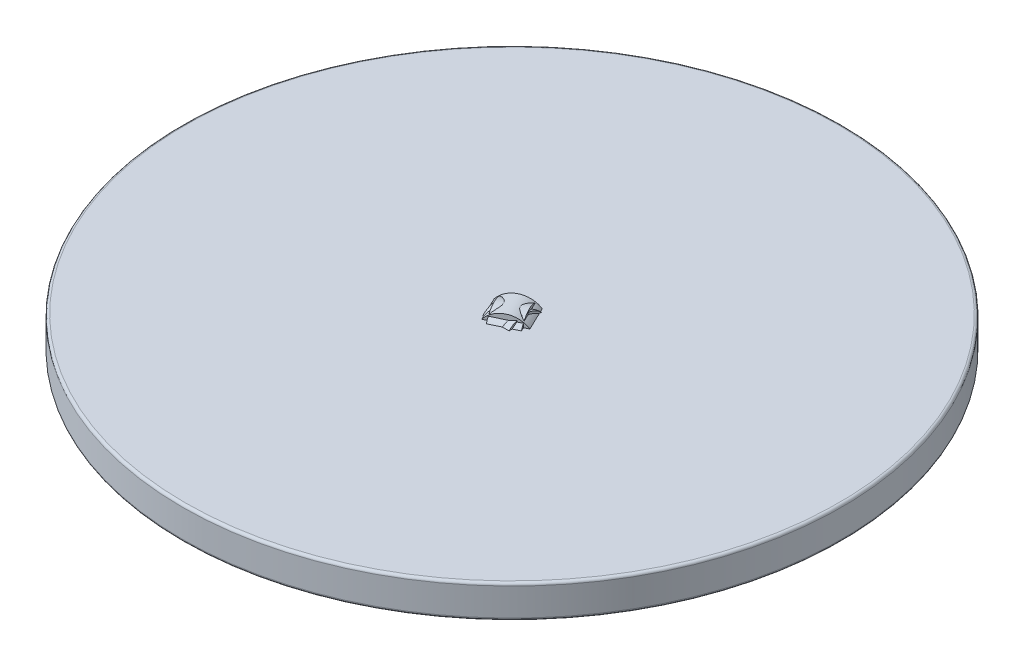
from build123d import *

# Parameters (mm, degrees)
SKETCH1_R           = 250000
BOSS_EXTRUDE1_DEPTH = 25000
FILLET1_R           = 2000
SKETCH2_R           = 17500
BOSS_EXTRUDE2_DEPTH = 10000
SKETCH4_R           = 17500
BOSS_EXTRUDE3_DEPTH = 10000
SKETCH5_R           = 17500
BOSS_EXTRUDE4_DEPTH = 10000


with BuildPart() as part:
    # Sketch1 → Boss-Extrude1 (new body)
    with BuildSketch(Plane(origin=(0, 0, 0), x_dir=(1, 0, 0), z_dir=(0, 1, 0))):
        with Locations(Location((0, 0, 0), (0, 0, 270))):
            Circle(SKETCH1_R)
    extrude(amount=-BOSS_EXTRUDE1_DEPTH)

    # Fillet1
    fillet1_edges = [part.edges().sort_by_distance(p)[0] for p in [
        (0, 0, -250000),
        (0, -25000, -250000),
    ]]
    fillet(fillet1_edges, radius=FILLET1_R)

    # Sketch2 → Boss-Extrude2 (add, symmetric)
    with BuildSketch(Plane(origin=(0, 0, 0), x_dir=(0, 0, -1), z_dir=(1, 0, 0))):
        with Locations((0, -12500)):
            Circle(SKETCH2_R)
    extrude(amount=BOSS_EXTRUDE2_DEPTH, both=True)

    # Sketch5 → Boss-Extrude4 (add, symmetric)
    with BuildSketch(Plane(origin=(0, 0, 0), x_dir=(-0.432731067584773, 0, -0.9015230574682729), z_dir=(0.9015230574682729, 0, -0.432731067584773))):
        with Locations((0, -11500)):
            Circle(SKETCH5_R)
    extrude(amount=BOSS_EXTRUDE4_DEPTH, both=True)


with BuildPart() as body_2:
    # Sketch4 → Boss-Extrude3 (new, symmetric)
    with BuildSketch(Plane(origin=(0, 0, 0), x_dir=(0.9015230574682728, 0, -0.4327310675847731), z_dir=(0.4327310675847731, 0, 0.9015230574682728))):
        with Locations((0, -10857.13405129)):
            Circle(SKETCH4_R)
    extrude(amount=BOSS_EXTRUDE3_DEPTH, both=True)


solid = Compound([part.part, body_2.part])
